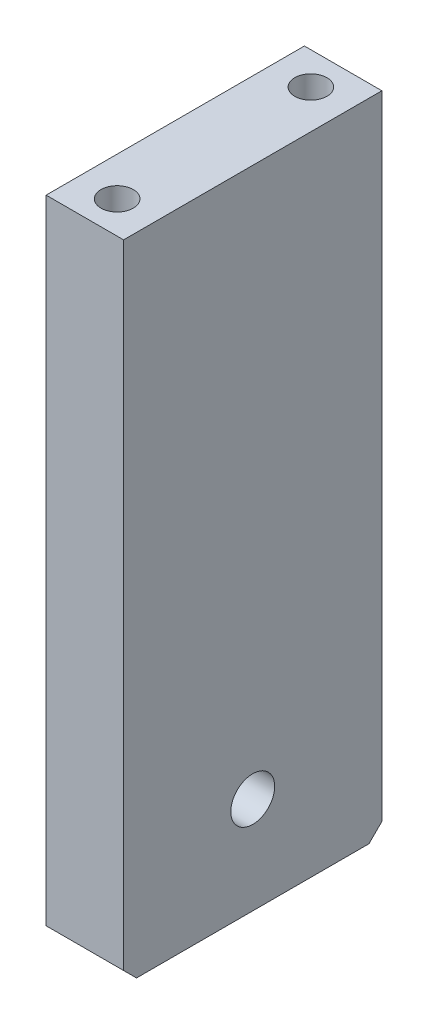
from build123d import *

# Parameters (mm, degrees)
SKETCH_1_W             = 12
SKETCH_1_H             = 40
EXTRUDE_1_DEPTH        = 100
HOLE_WIZARD_M6_1_D     = 5
HOLE_WIZARD_M6_1_DEPTH = 15
HOLE_WIZARD_M6_1_TIP   = 1.502151548
HOLE_WIZARD_M8_1_D     = 6.8
CHAMFER_1_SIZE         = 2


with BuildPart() as part:
    # 草图1 → 凸台-拉伸1 (new body)
    with BuildSketch(Plane(origin=(0, 0, 0), x_dir=(1, 0, 0), z_dir=(0, 1, 0))):
        Rectangle(SKETCH_1_W, SKETCH_1_H)
    extrude(amount=EXTRUDE_1_DEPTH)

    # M6 螺纹孔1
    with Locations(Plane(origin=(0, 100, 0), x_dir=(1, 0, 0), z_dir=(0, 1, 0))):
        with Locations((0, 15), (0, -15)):
            Hole(HOLE_WIZARD_M6_1_D / 2, depth=HOLE_WIZARD_M6_1_DEPTH)
            with Locations((0, 0, -(HOLE_WIZARD_M6_1_DEPTH + HOLE_WIZARD_M6_1_TIP / 2))):  # 118° drill point
                Cone(0, HOLE_WIZARD_M6_1_D / 2, HOLE_WIZARD_M6_1_TIP, mode=Mode.SUBTRACT)

    # M8 螺纹孔1 (through all)
    with Locations(Plane(origin=(6, 0, 0), x_dir=(0, 0, -1), z_dir=(1, 0, 0))):
        with Locations((0, 15)):
            Hole(HOLE_WIZARD_M8_1_D / 2)

    # 倒角1
    chamfer_1_edges = [part.edges().sort_by_distance(p)[0] for p in [
        (0, 0, 20),
        (0, 0, -20),
    ]]
    chamfer(chamfer_1_edges, length=CHAMFER_1_SIZE)


solid = part.part
